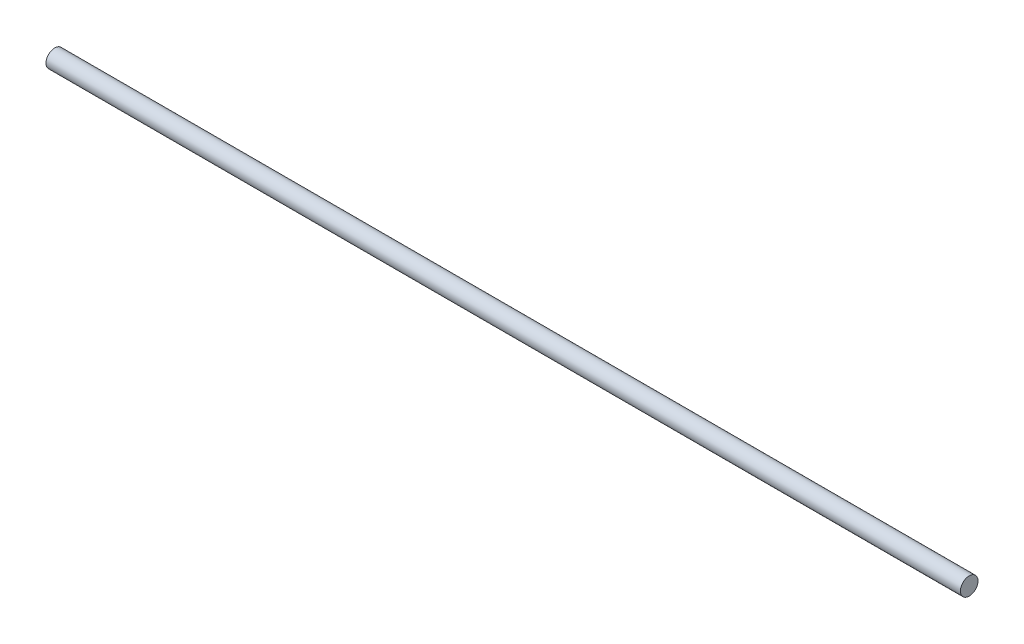
from build123d import *

# Parameters (mm, degrees)
SKETCH1_R           = 9
BOSS_EXTRUDE1_DEPTH = 468


with BuildPart() as part:
    # Sketch1 → Boss-Extrude1 (new, symmetric)
    with BuildSketch(Plane(origin=(0, 0, 0), x_dir=(0, 0, -1), z_dir=(1, 0, 0))):
        Circle(SKETCH1_R)
    extrude(amount=BOSS_EXTRUDE1_DEPTH, both=True)


solid = part.part
